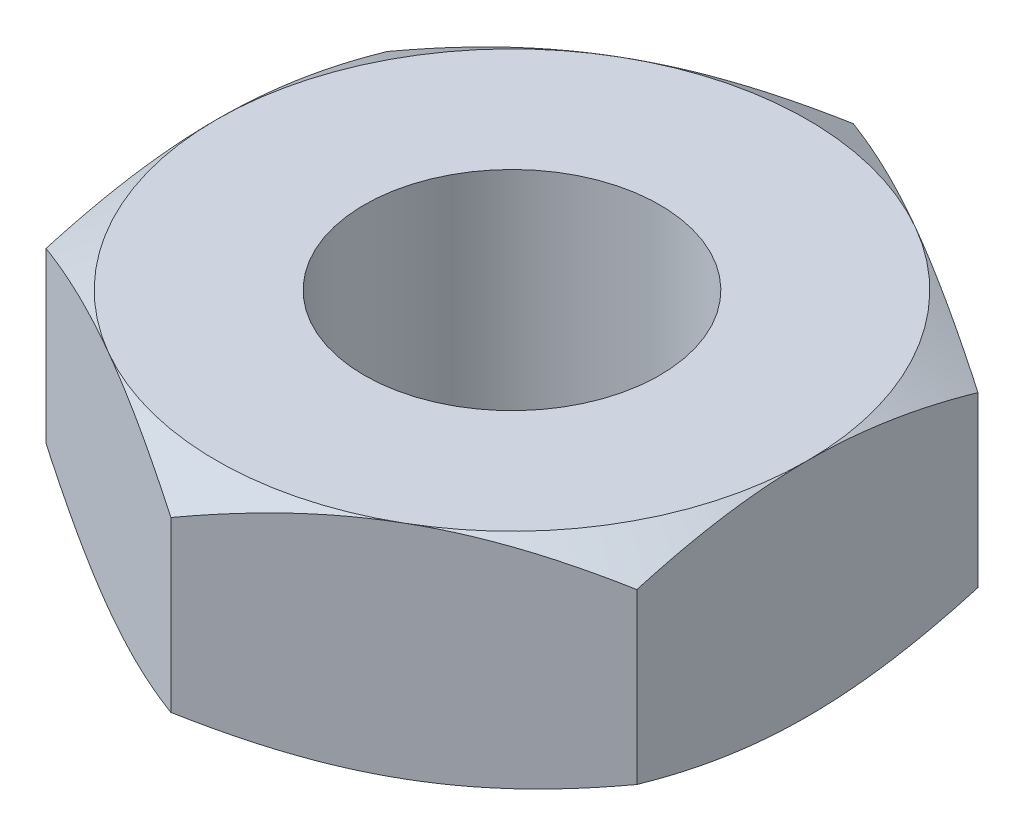
from build123d import *

# Parameters (mm, degrees)
SKETCH1_R               = 1
BOSS_EXTRUDE1_DEPTH     = 1.5
SKETCH2_OUTSIDE_W       = 14.186
SKETCH2_OUTSIDE_H       = 14.804
SKETCH2_OUTSIDE_R       = 2
CUT_EXTRUDE1_DEPTH      = 2
CUT_EXTRUDE1_DRAFT      = -60
MIRROR1_COPY_1_SKETCH_W = 14.186
MIRROR1_COPY_1_SKETCH_H = 14.804
MIRROR1_COPY_1_SKETCH_R = 2
MIRROR1_COPY_1_DEPTH    = 2
MIRROR1_COPY_1_DRAFT    = -60


with BuildPart() as part:
    # Sketch1 → Boss-Extrude1 (new body)
    with BuildSketch(Plane(origin=(0, 0, 0), x_dir=(1, 0, 0), z_dir=(0, 1, 0))):
        Polygon((0, 2.309401077), (-2, 1.154700538), (-2, -1.154700538), (0, -2.309401077), (2, -1.154700538), (2, 1.154700538), align=None)
        with Locations(Location((0, 0, 0), (0, 0, 270))):
            Circle(SKETCH1_R, mode=Mode.SUBTRACT)
    extrude(amount=BOSS_EXTRUDE1_DEPTH)


with BuildPart() as cut_extrude1_tool:
    # Sketch2 outside → Cut-Extrude1 (with draft: the straight prism first)
    with BuildSketch(Plane(origin=(0, 1.5, 0), x_dir=(1, 0, 0), z_dir=(0, 1, 0))):
        Rectangle(SKETCH2_OUTSIDE_W, SKETCH2_OUTSIDE_H)
        Circle(SKETCH2_OUTSIDE_R, mode=Mode.SUBTRACT)
    extrude(amount=-CUT_EXTRUDE1_DEPTH)
    # Cut-Extrude1: the draft: its side faces are tilted about the plane it starts from
    cut_extrude1_sides = [cut_extrude1_tool.faces().sort_by_distance(p)[0] for p in [
        (0, 0.5, 7.402),
        (7.093, 0.5, 0),
        (0, 0.5, -7.402),
        (-7.093, 0.5, 0),
        (-2, 0.5, 0),
    ]]
    draft(cut_extrude1_sides, Plane(origin=(0, 1.5, 0), x_dir=(1, 0, 0), z_dir=(0, 1, 0)), CUT_EXTRUDE1_DRAFT)


with BuildPart() as part_1:
    add(part.part)

    # Cut-Extrude1: cut by cut_extrude1_tool
    add(cut_extrude1_tool.part, mode=Mode.SUBTRACT)


with BuildPart() as mirror1_copy_1_tool:
    # Mirror1 copy 1 sketch → Mirror1 copy 1 (with draft: the straight prism first)
    with BuildSketch(Plane.XZ):
        Rectangle(MIRROR1_COPY_1_SKETCH_W, MIRROR1_COPY_1_SKETCH_H)
        Circle(MIRROR1_COPY_1_SKETCH_R, mode=Mode.SUBTRACT)
    extrude(amount=-MIRROR1_COPY_1_DEPTH)
    # Mirror1 copy 1: the draft: its side faces are tilted about the plane it starts from
    mirror1_copy_1_sides = [mirror1_copy_1_tool.faces().sort_by_distance(p)[0] for p in [
        (0, 1, 7.402),
        (7.093, 1, 0),
        (0, 1, -7.402),
        (-7.093, 1, 0),
        (-2, 1, 0),
    ]]
    draft(mirror1_copy_1_sides, Plane.XZ, MIRROR1_COPY_1_DRAFT)


with BuildPart() as part_2:
    add(part_1.part)

    # Mirror1 copy 1: cut by mirror1_copy_1_tool
    add(mirror1_copy_1_tool.part, mode=Mode.SUBTRACT)


solid = part_2.part
